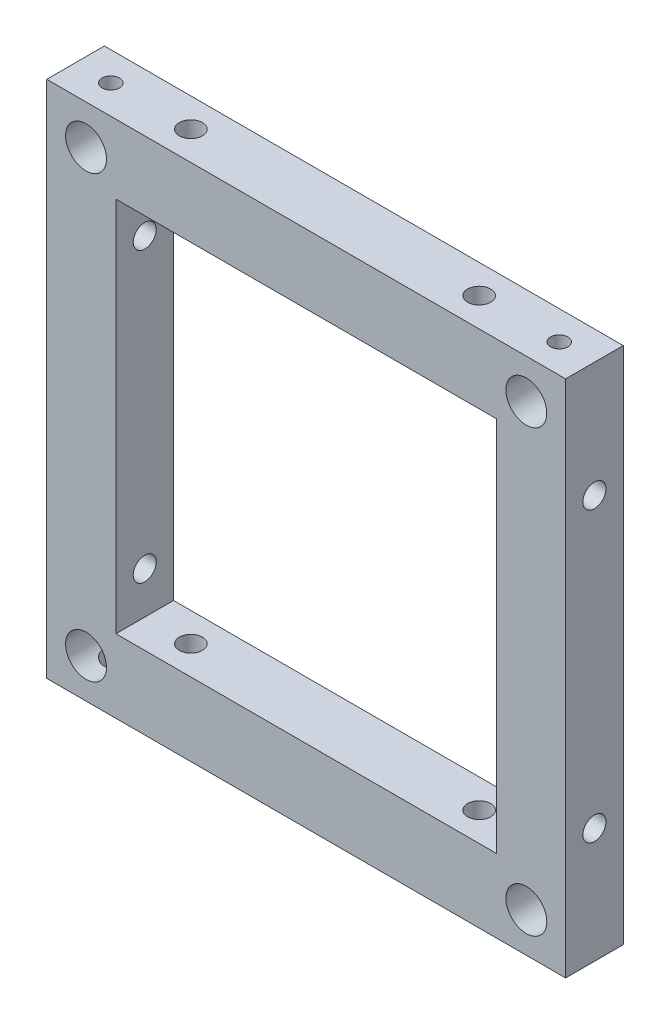
from build123d import *

# Parameters (mm, degrees)
SKETCH1_W           = 90
SKETCH1_H           = 90
SKETCH1_R           = 3.55
SKETCH1_W_2         = 66
SKETCH1_H_2         = 65.290786417
BOSS_EXTRUDE1_DEPTH = 10
CUT_EXTRUDE1_REACH  = 103.119
SKETCH2_R           = 1.5
SKETCH3_R           = 2
CUT_EXTRUDE2_DEPTH  = 90
SKETCH4_R           = 2
CUT_EXTRUDE3_DEPTH  = 90


with BuildPart() as part:
    # Sketch1 → Boss-Extrude1 (new body)
    with BuildSketch(Plane.XY):
        Rectangle(SKETCH1_W, SKETCH1_H)
        with Locations((-38.185, 38.182532328)):
            Circle(SKETCH1_R, mode=Mode.SUBTRACT)
        with Locations(Location((38.185, 38.182532328, 0), (0, 0, 180))):
            Circle(SKETCH1_R, mode=Mode.SUBTRACT)
        with Locations((38.185, -38.182532328)):
            Circle(SKETCH1_R, mode=Mode.SUBTRACT)
        with Locations(Location((-38.185, -38.182532328, 0), (0, 0, 180))):
            Circle(SKETCH1_R, mode=Mode.SUBTRACT)
        with Locations((0, 0.354606792)):
            Rectangle(SKETCH1_W_2, SKETCH1_H_2, mode=Mode.SUBTRACT)
    extrude(amount=BOSS_EXTRUDE1_DEPTH)

    # Sketch2 → Cut-Extrude1 (cut, up to next)
    with BuildSketch(Plane.XZ.offset(45), mode=Mode.PRIVATE) as cut_extrude1_sk1:
        with Locations((-38.89, 5)):
            Circle(SKETCH2_R)
    cut_extrude1_tool1 = extrude(cut_extrude1_sk1.sketch, amount=-CUT_EXTRUDE1_REACH, mode=Mode.PRIVATE) & part.part
    # Sketch2 → Cut-Extrude1 (cut, up to next)
    with BuildSketch(Plane.XZ.offset(45), mode=Mode.PRIVATE) as cut_extrude1_sk2:
        with Locations((38.89, 5)):
            Circle(SKETCH2_R)
    cut_extrude1_tool2 = extrude(cut_extrude1_sk2.sketch, amount=-CUT_EXTRUDE1_REACH, mode=Mode.PRIVATE) & part.part
    cut_extrude1_1 = cut_extrude1_tool1.solids().sort_by_distance((-38.89, -45, 5))[0]
    add(cut_extrude1_1, mode=Mode.SUBTRACT)
    cut_extrude1_2 = cut_extrude1_tool2.solids().sort_by_distance((38.89, -45, 5))[0]
    add(cut_extrude1_2, mode=Mode.SUBTRACT)
    cut_extrude1 = cut_extrude1_1 + cut_extrude1_2  # Cut-Extrude1 as one shape, for the pattern or mirror that repeats it

    # Mirror1: Cut-Extrude1 across plane
    add(cut_extrude1.mirror(Plane.ZX), mode=Mode.SUBTRACT)

    # Sketch3 → Cut-Extrude2 (cut)
    with BuildSketch(Plane.XZ.offset(45)):
        with Locations((-25, 5)):
            Circle(SKETCH3_R)
        with Locations((25, 5)):
            Circle(SKETCH3_R)
    extrude(amount=-CUT_EXTRUDE2_DEPTH, mode=Mode.SUBTRACT)

    # Sketch4 → Cut-Extrude3 (cut)
    with BuildSketch(Plane.ZY.offset(45)):
        with Locations(Location((5, 25, 0), (0, 0, 270))):
            Circle(SKETCH4_R)
        with Locations(Location((5, -25, 0), (0, 0, 270))):
            Circle(SKETCH4_R)
    extrude(amount=-CUT_EXTRUDE3_DEPTH, mode=Mode.SUBTRACT)


solid = part.part
